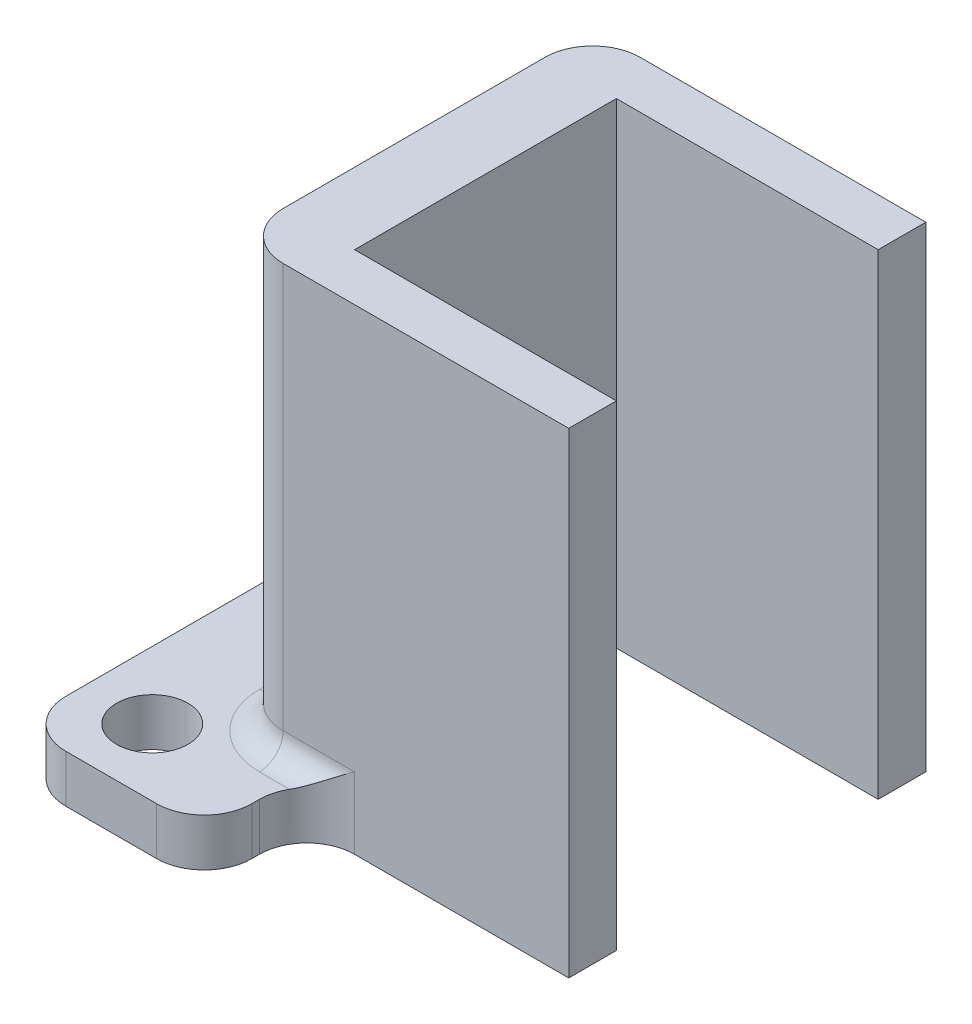
from build123d import *

# Parameters (mm, degrees)
SKETCH1_R           = 1.5
SKETCH1_W           = 11
SKETCH1_H           = 2
BOSS_EXTRUDE1_DEPTH = 2
BOSS_EXTRUDE2_DEPTH = 20
FILLET2_R           = 2
FILLET3_R           = 1


with BuildPart() as part:
    # Sketch1 → Boss-Extrude1 (new body)
    # profile 1 of 7: a face of its own
    with BuildSketch(Plane(origin=(0, 0, 0), x_dir=(1, 0, 0), z_dir=(0, 1, 0))):
        Polygon((0, -6.315863562), (0, -2), (-3, -2), (-3, 13), (0, 13), (0, 17.315863562), (-7.816047118, 17.315863562), (-7.816047118, -6.315863562), align=None)
        with Locations((-5, -3.5)):
            Circle(SKETCH1_R, mode=Mode.SUBTRACT)
        with Locations((-5, 14.5)):
            Circle(SKETCH1_R, mode=Mode.SUBTRACT)
    # profile 2 of 7: a face of its own
    with BuildSketch(Plane(origin=(0, 0, 0), x_dir=(1, 0, 0), z_dir=(0, 1, 0))):
        Polygon((0, -2), (0, 0), (0, 11), (0, 13), (-3, 13), (-3, -2), align=None)
    # profile 3 of 7: a face of its own
    with BuildSketch(Plane(origin=(0, 0, 0), x_dir=(1, 0, 0), z_dir=(0, 1, 0))):
        Polygon((0, -6.315863562), (0, -2), (-3, -2), (-3, 13), (0, 13), (0, 17.315863562), (-7.816047118, 17.315863562), (-7.816047118, -6.315863562), align=None)
        with Locations((-5, -3.5)):
            Circle(SKETCH1_R, mode=Mode.SUBTRACT)
        with Locations((-5, 14.5)):
            Circle(SKETCH1_R, mode=Mode.SUBTRACT)
    # profile 4 of 7: a face of its own
    with BuildSketch(Plane(origin=(0, 0, 0), x_dir=(1, 0, 0), z_dir=(0, 1, 0))):
        Polygon((0, -6.315863562), (0, -2), (-3, -2), (-3, 13), (0, 13), (0, 17.315863562), (-7.816047118, 17.315863562), (-7.816047118, -6.315863562), align=None)
        with Locations((-5, -3.5)):
            Circle(SKETCH1_R, mode=Mode.SUBTRACT)
        with Locations((-5, 14.5)):
            Circle(SKETCH1_R, mode=Mode.SUBTRACT)
    # profile 5 of 7: a face of its own
    with BuildSketch(Plane(origin=(0, 0, 0), x_dir=(1, 0, 0), z_dir=(0, 1, 0))):
        with Locations((5.5, -1)):
            Rectangle(SKETCH1_W, SKETCH1_H)
    # profile 6 of 7: a face of its own
    with BuildSketch(Plane(origin=(0, 0, 0), x_dir=(1, 0, 0), z_dir=(0, 1, 0))):
        Polygon((0, -2), (0, 0), (0, 11), (0, 13), (-3, 13), (-3, -2), align=None)
    # profile 7 of 7: a face of its own
    with BuildSketch(Plane(origin=(0, 0, 0), x_dir=(1, 0, 0), z_dir=(0, 1, 0))):
        with Locations((5.5, 12)):
            Rectangle(SKETCH1_W, SKETCH1_H)
    extrude(amount=BOSS_EXTRUDE1_DEPTH)

    # Sketch1<3> → Boss-Extrude2 (add)
    with BuildSketch(Plane(origin=(0, 0, 0), x_dir=(1, 0, 0), z_dir=(0, 1, 0))):
        Polygon((-3, -2), (11, -2), (11, 0), (0, 0), (0, 11), (11, 11), (11, 13), (-3, 13), align=None)
    extrude(amount=BOSS_EXTRUDE2_DEPTH)

    # Fillet2
    fillet2_edges = [part.edges().sort_by_distance(p)[0] for p in [
        (-3, 11, 2),
        (-3, 11, -13),
        (0, 1, 6.315863562),
        (0, 1, 2),
        (-7.816047118, 1, 6.315863562),
        (-7.816047118, 1, -17.315863562),
        (0, 1, -17.315863562),
        (0, 1, -13),
    ]]
    fillet(fillet2_edges, radius=FILLET2_R)

    # Fillet3
    fillet3_edges = [part.edges().sort_by_distance(p)[0] for p in [
        (0.5, 2, 2),
        (0.5, 2, -13),
        (-2.414213562, 2, 1.414213562),
        (-2.414213562, 2, -12.414213562),
        (-3, 2, -5.5),
    ]]
    fillet(fillet3_edges, radius=FILLET3_R)


solid = part.part
